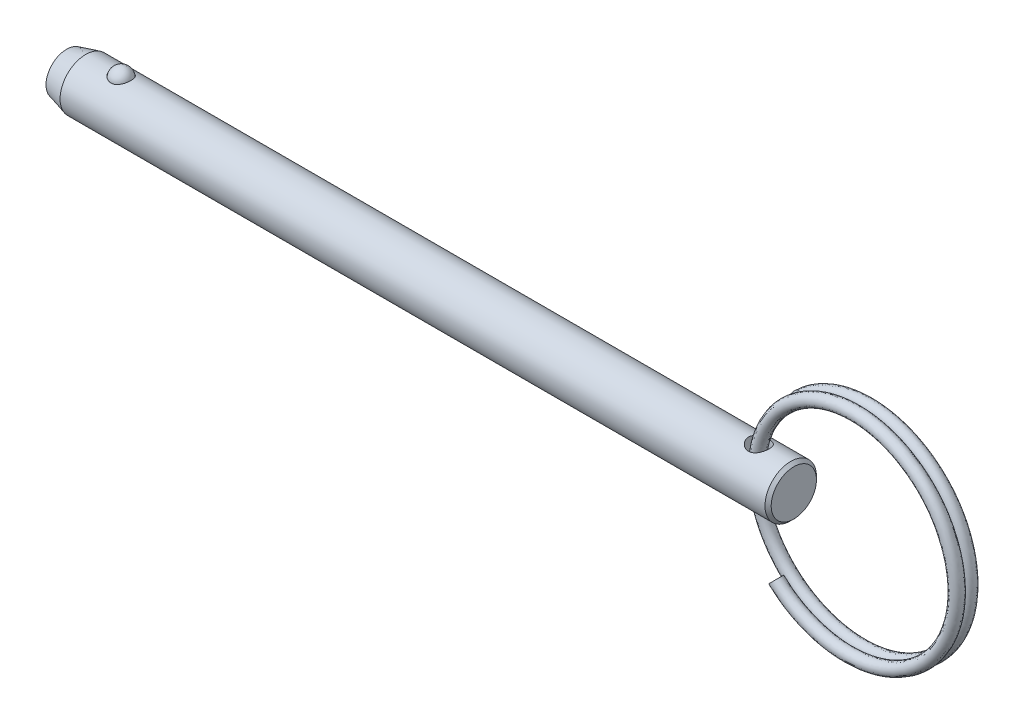
from build123d import *

# Parameters (mm, degrees)
SKETCH4_W          = 1.27
SKETCH4_H          = 6.35
SWEEP1_PITCH       = 1.5494
SWEEP1_HEIGHT      = 1.355725
SWEEP1_RADIUS      = 13.462
SKETCH6_R          = 0.762
SWEEP2_PITCH       = 1.5494
SWEEP2_HEIGHT      = 1.355725
SWEEP2_RADIUS      = 13.462
SWEEP2_START_ANGLE = -180
SKETCH6_2_R        = 0.762


with BuildPart() as part:
    # Sketch1 → Revolve1 (revolve)
    with BuildSketch(Plane.XY, mode=Mode.PRIVATE) as revolve1_sk:
        Polygon((44.8564, 2.794), (44.4754, 3.175), (-42.486547737, 3.175), (-44.8564, 2.54), (-44.8564, 0), (44.8564, 0), align=None)
    revolve(revolve1_sk.sketch.rotate(Axis((44.8564, 0, 0), (1, 0, 0)), 90), axis=Axis((44.8564, 0, 0), (1, 0, 0)))

    # Sketch2 → Cut-Revolve1 (revolve, cut)
    with BuildSketch(Plane.XY):
        with BuildLine():
            Line((-36.864582051, 2.8575), (-39.379182051, 2.8575))
            ThreePointArc((-39.379182051, 2.8575), (-38.121882051, 4.1148), (-36.864582051, 2.8575))
        make_face()
    revolve(axis=Axis((-36.864582051, 2.8575, 0), (1, 0, 0)), mode=Mode.SUBTRACT)

    # Sketch4 → Cut-Revolve2 (revolve, cut)
    with BuildSketch(Plane.XY, mode=Mode.PRIVATE) as cut_revolve2_sk:
        with Locations((41.1734, 0)):
            Rectangle(SKETCH4_W, SKETCH4_H)
    revolve(cut_revolve2_sk.sketch.rotate(Axis((40.5384, -3.175, 0), (0, 1, 0)), 90), axis=Axis((40.5384, -3.175, 0), (0, 1, 0)), mode=Mode.SUBTRACT)


with BuildPart() as body_2:
    # Sketch3 → Revolve2 (revolve)
    with BuildSketch(Plane.XY):
        with BuildLine():
            Line((-36.889982051, 2.8575), (-39.353782051, 2.8575))
            ThreePointArc((-39.353782051, 2.8575), (-38.121882051, 4.0894), (-36.889982051, 2.8575))
        make_face()
    revolve(axis=Axis((-36.889982051, 2.8575, 0), (1, 0, 0)))


with BuildPart() as body_3:
    # Sweep1: sweep along a helix
    with BuildLine() as sweep1_path:
        Helix(SWEEP1_PITCH, SWEEP1_HEIGHT, SWEEP1_RADIUS, center=(53.023425091, 0, 0), direction=(0, 0, -1), lefthand=True)
    # Sketch6 → Sweep1 (sweep)
    with BuildSketch(Plane(origin=(114.003847968, 0, 0), x_dir=(0, 0, -1), z_dir=(0, 1, 0))):
        with Locations((0, 73.680422877)):
            Circle(SKETCH6_R)
    sweep(path=sweep1_path.line, is_frenet=True)

    # Sweep2: sweep along a helix
    with BuildLine() as sweep2_path:
        add(Helix(SWEEP2_PITCH, SWEEP2_HEIGHT, SWEEP2_RADIUS, center=(53.023425091, 0, 0), direction=(0, 0, 1), lefthand=True, mode=Mode.PRIVATE).rotate(Axis((53.023425091, 0, 0), (0, 0, 1)), SWEEP2_START_ANGLE))
    # Sketch6<2> → Sweep2 (sweep)
    with BuildSketch(Plane(origin=(114.003847968, 0, 0), x_dir=(0, 0, -1), z_dir=(0, 1, 0))):
        with Locations((0, 73.680422877)):
            Circle(SKETCH6_2_R)
    sweep(path=sweep2_path.line, is_frenet=True)


solid = Compound([part.part, body_2.part, body_3.part])
